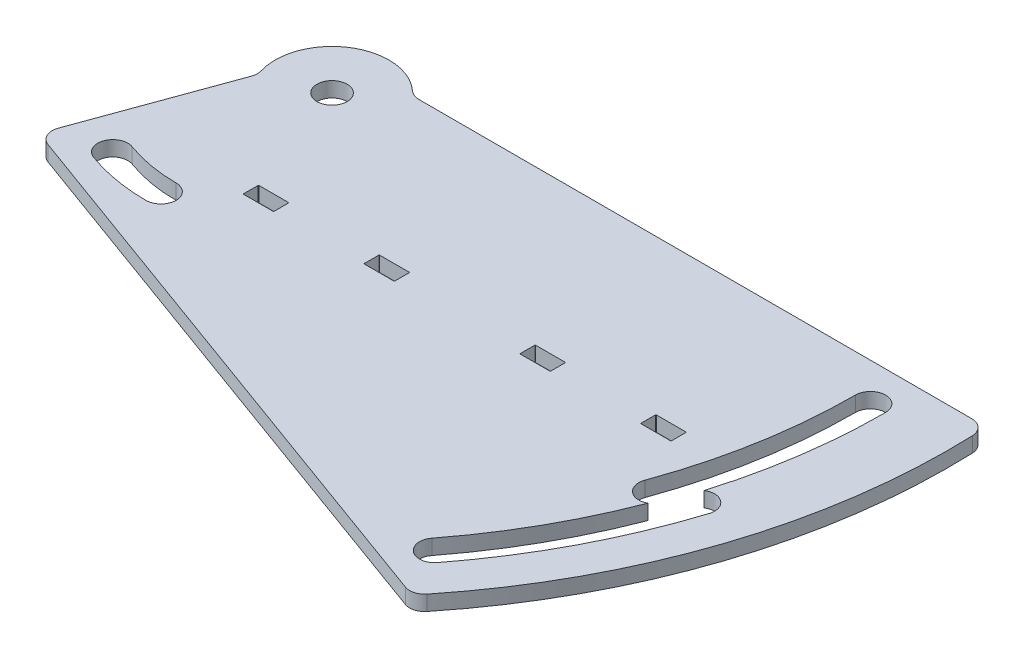
from build123d import *

# Parameters (mm, degrees)
SKETCH1_R           = 3
BOSS_EXTRUDE1_DEPTH = 3
FILLET1_R           = 3
CUT_EXTRUDE1_REACH  = 98.569
WELD_SKETCH_W       = 6.05
WELD_SKETCH_H       = 3.05
FILLET2_R           = 0.1


with BuildPart() as part:
    # Sketch1 → Boss-Extrude1 (new body)
    with BuildSketch(Plane(origin=(0, 0, 0), x_dir=(1, 0, 0), z_dir=(0, 1, 0))):
        with BuildLine():
            Line((68.999142959, 24.5), (-45.03, 24.5))
            ThreePointArc((-45.03, 24.5), (-59.42765336, 26.658455117), (-64.053442962, 12.85434626))
            Line((-64.053442962, 12.85434626), (-75.682127835, -19.095202846))
            Line((-75.682127835, -19.095202846), (40.839757142, -61.505700619))
            ThreePointArc((40.839757142, -61.505700619), (63.135225428, -21.192802103), (68.999142959, 24.5))
        make_face()
        with BuildLine():
            ThreePointArc((-66.169745277, -17.768626979), (-67.962762758, -13.923488739), (-64.117624541, -12.130471209))
            ThreePointArc((-64.117624541, -12.130471209), (-58.898093563, -13.529040334), (-53.515000008, -14))
            ThreePointArc((-53.515000008, -14), (-50.515, -17.000000016), (-53.51500004, -20))
            ThreePointArc((-53.51500004, -20), (-59.93998258, -19.43788686), (-66.169745277, -17.768626979))
        make_face(mode=Mode.SUBTRACT)
        with Locations(Location((-53.515, 17, 0), (0, 0, 270))):
            Circle(SKETCH1_R, mode=Mode.SUBTRACT)
        with BuildLine():
            ThreePointArc((51.922241647, -14.457733132), (55.352806586, -14.628825828), (56.374201386, -17.908277181))
            ThreePointArc((56.374201386, -17.908277181), (48.64297905, -36.460001059), (37.807738396, -53.387369951))
            ThreePointArc((37.807738396, -53.387369951), (33.600211268, -53.932086993), (33.055494505, -49.724559828))
            ThreePointArc((33.055494505, -49.724559828), (41.773694842, -36.541404897), (48.499417973, -22.238704473))
            ThreePointArc((48.499417973, -22.238704473), (45.1053197, -21.881948257), (44.241223395, -18.580355359))
            ThreePointArc((44.241223395, -18.580355359), (48.93455056, -1.064619844), (50.515, 17))
            ThreePointArc((50.515, 17), (53.515, 20), (56.515, 17))
            ThreePointArc((56.515, 17), (55.360756251, 1.104384228), (51.922241647, -14.457733132))
        make_face(mode=Mode.SUBTRACT)
    extrude(amount=BOSS_EXTRUDE1_DEPTH)

    # Fillet1
    fillet1_edges = [part.edges().sort_by_distance(p)[0] for p in [
        (68.999142959, 1.5, -24.5),
        (40.839757142, 1.5, 61.505700619),
        (-75.682127835, 1.5, 19.095202846),
        (-64.053442962, 1.5, -12.85434626),
        (-45.03, 1.5, -24.5),
    ]]
    fillet(fillet1_edges, radius=FILLET1_R)

    # weld sketch → Cut-Extrude1 (cut, up to next)
    with BuildSketch(Plane(origin=(0, 3, 0), x_dir=(1, 0, 0), z_dir=(0, 1, 0)), mode=Mode.PRIVATE) as cut_extrude1_sk1:
        with Locations((-41.915170648, -7.723381887)):
            Rectangle(WELD_SKETCH_W, WELD_SKETCH_H)
    cut_extrude1_tool1 = extrude(cut_extrude1_sk1.sketch, amount=-CUT_EXTRUDE1_REACH, mode=Mode.PRIVATE) & part.part
    # weld sketch → Cut-Extrude1 (cut, up to next)
    with BuildSketch(Plane(origin=(0, 3, 0), x_dir=(1, 0, 0), z_dir=(0, 1, 0)), mode=Mode.PRIVATE) as cut_extrude1_sk2:
        with Locations((-17.915170648, -7.723381887)):
            Rectangle(WELD_SKETCH_W, WELD_SKETCH_H)
    cut_extrude1_tool2 = extrude(cut_extrude1_sk2.sketch, amount=-CUT_EXTRUDE1_REACH, mode=Mode.PRIVATE) & part.part
    # weld sketch → Cut-Extrude1 (cut, up to next)
    with BuildSketch(Plane(origin=(0, 3, 0), x_dir=(1, 0, 0), z_dir=(0, 1, 0)), mode=Mode.PRIVATE) as cut_extrude1_sk3:
        with Locations((37.084829352, -7.723381887)):
            Rectangle(WELD_SKETCH_W, WELD_SKETCH_H)
    cut_extrude1_tool3 = extrude(cut_extrude1_sk3.sketch, amount=-CUT_EXTRUDE1_REACH, mode=Mode.PRIVATE) & part.part
    # weld sketch → Cut-Extrude1 (cut, up to next)
    with BuildSketch(Plane(origin=(0, 3, 0), x_dir=(1, 0, 0), z_dir=(0, 1, 0)), mode=Mode.PRIVATE) as cut_extrude1_sk4:
        with Locations((13.084829352, -7.723381887)):
            Rectangle(WELD_SKETCH_W, WELD_SKETCH_H)
    cut_extrude1_tool4 = extrude(cut_extrude1_sk4.sketch, amount=-CUT_EXTRUDE1_REACH, mode=Mode.PRIVATE) & part.part
    add(cut_extrude1_tool1.solids().sort_by_distance((-41.915171, 3, 7.723382))[0], mode=Mode.SUBTRACT)
    add(cut_extrude1_tool2.solids().sort_by_distance((-17.915171, 3, 7.723382))[0], mode=Mode.SUBTRACT)
    add(cut_extrude1_tool3.solids().sort_by_distance((37.084829, 3, 7.723382))[0], mode=Mode.SUBTRACT)
    add(cut_extrude1_tool4.solids().sort_by_distance((13.084829, 3, 7.723382))[0], mode=Mode.SUBTRACT)

    # Fillet2
    fillet2_edges = [part.edges().sort_by_distance(p)[0] for p in [
        (-38.890170648, 1.5, 9.248381887),
        (-44.940170648, 1.5, 9.248381887),
        (-44.940170648, 1.5, 6.198381887),
        (-38.890170648, 1.5, 6.198381887),
        (-14.890170648, 1.5, 9.248381887),
        (-20.940170648, 1.5, 9.248381887),
        (-20.940170648, 1.5, 6.198381887),
        (-14.890170648, 1.5, 6.198381887),
        (10.059829352, 1.5, 9.248381887),
        (10.059829352, 1.5, 6.198381887),
        (16.109829352, 1.5, 6.198381887),
        (16.109829352, 1.5, 9.248381887),
        (40.109829352, 1.5, 6.198381887),
        (40.109829352, 1.5, 9.248381887),
        (34.059829352, 1.5, 9.248381887),
        (34.059829352, 1.5, 6.198381887),
    ]]
    fillet(fillet2_edges, radius=FILLET2_R)


solid = part.part
